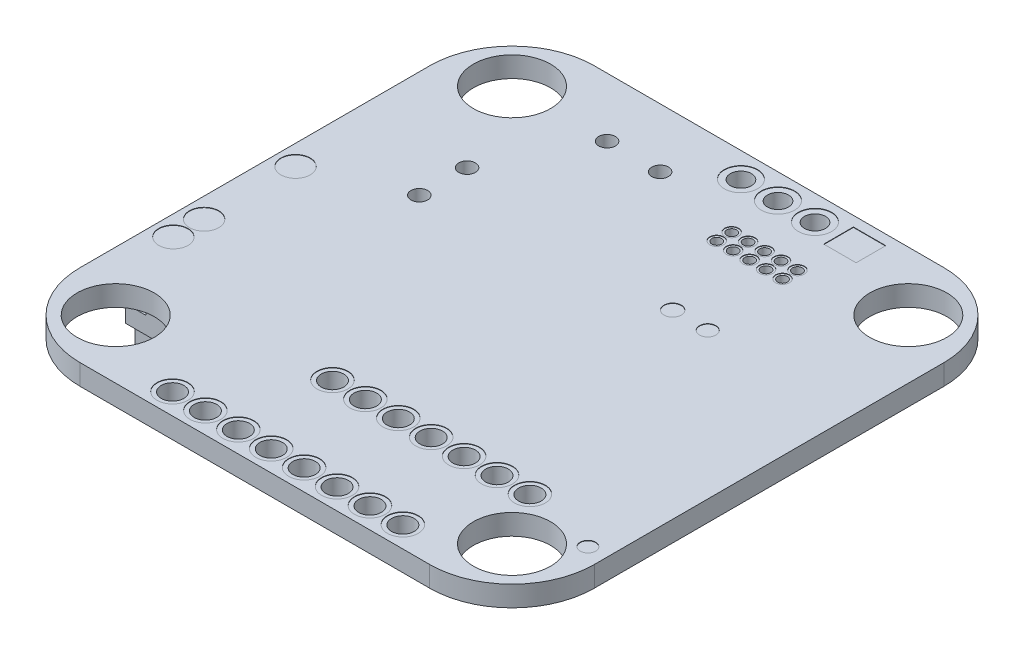
from build123d import *

# Parameters (mm, degrees)
SKETCH1_W           = 31.75
SKETCH1_H           = 31.75
BOSS_EXTRUDE1_DEPTH = 1.27
FILLET1_R           = 5.08
SKETCH2_R           = 2.38125
SKETCH2_R_2         = 0.513227476
CUT_EXTRUDE1_DEPTH  = 2540
SKETCH6_R           = 1.027987033
SKETCH6_R_2         = 0.426271727
SKETCH6_R_3         = 0.905059833
SKETCH6_R_4         = 0.504587533
SKETCH6_R_5         = 0.534547711
SKETCH6_R_6         = 0.478723023
SKETCH6_R_7         = 0.952228923
SKETCH6_W           = 1.997854961
SKETCH6_H           = 1.831367048
CUT_EXTRUDE2_DEPTH  = 0.0254
SKETCH7_W           = 14.734180338
SKETCH7_H           = 15.857973755
SKETCH7_W_2         = 4.578070361
SKETCH7_H_2         = 7.36709017
BOSS_EXTRUDE5_DEPTH = 1.905
SKETCH8_W           = 14.882958641
SKETCH8_H           = 1.379983815
CUT_EXTRUDE3_DEPTH  = 13.97
SKETCH10_W          = 6.798713526
SKETCH10_H          = 1.33450517
CUT_EXTRUDE4_DEPTH  = 3.81
CUT_EXTRUDE5_DEPTH  = 1.27
SKETCH12_W          = 3.03840442
SKETCH12_H          = 3.829222009
SKETCH12_H_2        = 3.995709922
CUT_EXTRUDE6_DEPTH  = 1.27
SKETCH13_W          = 1.664879134
SKETCH13_H          = 9.656298979
CUT_EXTRUDE7_DEPTH  = 0.239775287
SKETCH14_W          = 1.415147264
SKETCH14_H          = 1.456769243
SKETCH14_H_2        = 1.623257156
SKETCH14_W_2        = 1.540013199
SKETCH14_H_3        = 0.832439567
SKETCH14_H_4        = 0.998927481
CUT_EXTRUDE8_DEPTH  = 1.27
BOSS_EXTRUDE6_DEPTH = 4.572
SKETCH16_W          = 0.680432362
SKETCH16_H          = 0.441361532
SKETCH16_W_2        = 0.643652234
SKETCH16_W_3        = 0.555541417
SKETCH16_W_4        = 0.604797181
CUT_EXTRUDE9_DEPTH  = 4.572
SKETCH17_W          = 0.555541417
SKETCH17_H          = 0.734843187
SKETCH17_W_2        = 0.604797181
CUT_EXTRUDE10_DEPTH = 3.048
SKETCH18_W          = 0.555541417
SKETCH18_H          = 0.712608625
SKETCH18_W_2        = 0.604797181
SKETCH18_H_2        = 1.628576262
CUT_EXTRUDE11_DEPTH = 1.27
SKETCH21_R          = 0.698228923
SKETCH21_R_2        = 0.648998018
SKETCH21_R_3        = 0.301620328
CUT_EXTRUDE12_DEPTH = 16.002


with BuildPart() as part:
    # Sketch1 → Boss-Extrude1 (new body)
    with BuildSketch(Plane(origin=(0, 0, 0), x_dir=(1, 0, 0), z_dir=(0, 1, 0))):
        Rectangle(SKETCH1_W, SKETCH1_H)
    extrude(amount=BOSS_EXTRUDE1_DEPTH)

    # Fillet1
    fillet1_edges = [part.edges().sort_by_distance(p)[0] for p in [
        (-15.875, 0.635, -15.875),
        (15.875, 0.635, -15.875),
        (15.875, 0.635, 15.875),
        (-15.875, 0.635, 15.875),
    ]]
    fillet(fillet1_edges, radius=FILLET1_R)

    # Sketch2 → Cut-Extrude1 (cut)
    with BuildSketch(Plane(origin=(0, 1.27, 0), x_dir=(1, 0, 0), z_dir=(0, 1, 0))):
        with Locations(Location((12.235378749, 12.235378749, 0), (0, 0, 270))):
            Circle(SKETCH2_R)
        with Locations(Location((-12.235378749, 12.235378749, 0), (0, 0, 270))):
            Circle(SKETCH2_R)
        with Locations(Location((-12.235378749, -12.235378749, 0), (0, 0, 270))):
            Circle(SKETCH2_R)
        with Locations(Location((12.235378749, -12.235378749, 0), (0, 0, 270))):
            Circle(SKETCH2_R)
        with Locations(Location((-6.365121013, 12.235378749, 0), (0, 0, 270))):
            Circle(SKETCH2_R_2)
        with Locations(Location((-3.088320071, 12.235378749, 0), (0, 0, 270))):
            Circle(SKETCH2_R_2)
        with Locations(Location((-9.273281849, 6.498808589, 0), (0, 0, 270))):
            Circle(SKETCH2_R_2)
        with Locations(Location((-9.273281849, 3.549687741, 0), (0, 0, 270))):
            Circle(SKETCH2_R_2)
    extrude(amount=-CUT_EXTRUDE1_DEPTH, mode=Mode.SUBTRACT)

    # Sketch6 → Cut-Extrude2 (cut)
    with BuildSketch(Plane(origin=(0, 1.27, 0), x_dir=(1, 0, 0), z_dir=(0, 1, 0))):
        with Locations(Location((4.370307728, 14.338771544, 0), (0, 0, 270))):
            Circle(SKETCH6_R)
        with Locations(Location((2.084307728, 14.338771544, 0), (0, 0, 270))):
            Circle(SKETCH6_R)
        with Locations(Location((-0.201692272, 14.338771544, 0), (0, 0, 270))):
            Circle(SKETCH6_R)
        with Locations(Location((6.409784667, 11.217123168, 0), (0, 0, 270))):
            Circle(SKETCH6_R_2)
        with Locations(Location((6.409784667, 10.293398218, 0), (0, 0, 270))):
            Circle(SKETCH6_R_2)
        with Locations(Location((5.393784667, 11.217123168, 0), (0, 0, 270))):
            Circle(SKETCH6_R_2)
        with Locations(Location((5.393784667, 10.293398218, 0), (0, 0, 270))):
            Circle(SKETCH6_R_2)
        with Locations(Location((4.377784667, 11.217123168, 0), (0, 0, 270))):
            Circle(SKETCH6_R_2)
        with Locations(Location((4.377784667, 10.293398218, 0), (0, 0, 270))):
            Circle(SKETCH6_R_2)
        with Locations(Location((3.361784667, 11.217123168, 0), (0, 0, 270))):
            Circle(SKETCH6_R_2)
        with Locations(Location((3.361784667, 10.293398218, 0), (0, 0, 270))):
            Circle(SKETCH6_R_2)
        with Locations(Location((2.345784667, 11.217123168, 0), (0, 0, 270))):
            Circle(SKETCH6_R_2)
        with Locations(Location((2.345784667, 10.293398218, 0), (0, 0, 270))):
            Circle(SKETCH6_R_2)
        with Locations(Location((-14.634699345, 1.269473008, 0), (0, 0, 270))):
            Circle(SKETCH6_R_3)
        with Locations(Location((-14.634699345, -4.375397019, 0), (0, 0, 270))):
            Circle(SKETCH6_R_3)
        with Locations(Location((-14.634699345, -6.273101018, 0), (0, 0, 270))):
            Circle(SKETCH6_R_3)
        with Locations(Location((6.855725392, 5.229884908, 0), (0, 0, 270))):
            Circle(SKETCH6_R_4)
        with Locations(Location((4.691431935, 5.229884908, 0), (0, 0, 270))):
            Circle(SKETCH6_R_5)
        with Locations(Location((14.725883417, -10.038221661, 0), (0, 0, 270))):
            Circle(SKETCH6_R_6)
        with Locations(Location((10.121840972, -9.015101117, 0), (0, 0, 270))):
            Circle(SKETCH6_R_7)
        with Locations(Location((8.089840972, -9.015101117, 0), (0, 0, 270))):
            Circle(SKETCH6_R_7)
        with Locations(Location((6.057840972, -9.015101117, 0), (0, 0, 270))):
            Circle(SKETCH6_R_7)
        with Locations(Location((4.025840972, -9.015101117, 0), (0, 0, 270))):
            Circle(SKETCH6_R_7)
        with Locations(Location((1.993840972, -9.015101117, 0), (0, 0, 270))):
            Circle(SKETCH6_R_7)
        with Locations(Location((-0.038159028, -9.015101117, 0), (0, 0, 270))):
            Circle(SKETCH6_R_7)
        with Locations(Location((-2.070159028, -9.015101117, 0), (0, 0, 270))):
            Circle(SKETCH6_R_7)
        with Locations(Location((7.824931931, -14.563562525, 0), (0, 0, 270))):
            Circle(SKETCH6_R_7)
        with Locations(Location((5.792931931, -14.563562525, 0), (0, 0, 270))):
            Circle(SKETCH6_R_7)
        with Locations(Location((3.760931931, -14.563562525, 0), (0, 0, 270))):
            Circle(SKETCH6_R_7)
        with Locations(Location((1.728931931, -14.563562525, 0), (0, 0, 270))):
            Circle(SKETCH6_R_7)
        with Locations(Location((-0.303068069, -14.563562525, 0), (0, 0, 270))):
            Circle(SKETCH6_R_7)
        with Locations(Location((-2.335068069, -14.563562525, 0), (0, 0, 270))):
            Circle(SKETCH6_R_7)
        with Locations(Location((-4.367068069, -14.563562525, 0), (0, 0, 270))):
            Circle(SKETCH6_R_7)
        with Locations(Location((-6.399068069, -14.563562525, 0), (0, 0, 270))):
            Circle(SKETCH6_R_7)
        with Locations((6.826004451, 14.338771544)):
            Rectangle(SKETCH6_W, SKETCH6_H)
    extrude(amount=-CUT_EXTRUDE2_DEPTH, mode=Mode.SUBTRACT)

    # Sketch7 → Boss-Extrude5 (add)
    with BuildSketch(Plane.XZ):
        with Locations((5.223558284, -0.853250556)):
            Rectangle(SKETCH7_W, SKETCH7_H)
        with Locations((-13.089938565, -5.098692349)):
            Rectangle(SKETCH7_W_2, SKETCH7_H_2)
    extrude(amount=BOSS_EXTRUDE5_DEPTH)

    # Sketch8 → Cut-Extrude3 (cut)
    with BuildSketch(Plane(origin=(12.590648453, 0, 0), x_dir=(0, 0, -1), z_dir=(1, 0, 0))):
        with Locations((0.833352515, -0.929767195)):
            Rectangle(SKETCH8_W, SKETCH8_H)
    extrude(amount=-CUT_EXTRUDE3_DEPTH, mode=Mode.SUBTRACT)

    # Sketch10 → Cut-Extrude4 (cut)
    with BuildSketch(Plane.ZY.offset(15.378973745)):
        with Locations((-5.097593598, -0.899949488)):
            Rectangle(SKETCH10_W, SKETCH10_H)
    extrude(amount=-CUT_EXTRUDE4_DEPTH, mode=Mode.SUBTRACT)

    # Sketch11 → Cut-Extrude5 (cut)
    with BuildSketch(Plane.XZ.offset(1.905)):
        Polygon((12.590648453, 3.973420502), (7.75794531, 1.103415111), (7.75794531, -5.717764563), (12.590648453, -7.603711228), align=None)
    extrude(amount=-CUT_EXTRUDE5_DEPTH, mode=Mode.SUBTRACT)

    # Sketch12 → Cut-Extrude6 (cut)
    with BuildSketch(Plane.XZ.offset(0.239775287)):
        with Locations((4.953015425, -1.373525285)):
            Rectangle(SKETCH12_W, SKETCH12_H)
        with Locations((4.953015425, -5.82707697)):
            Rectangle(SKETCH12_W, SKETCH12_H_2)
    extrude(amount=-CUT_EXTRUDE6_DEPTH, mode=Mode.SUBTRACT)

    # Sketch13 → Cut-Extrude7 (cut)
    with BuildSketch(Plane.XZ.offset(0.239775287)):
        with Locations((11.758208886, -2.830294529)):
            Rectangle(SKETCH13_W, SKETCH13_H)
    extrude(amount=-CUT_EXTRUDE7_DEPTH, mode=Mode.SUBTRACT)

    # Sketch14 → Cut-Extrude8 (cut)
    with BuildSketch(Plane.XZ.offset(1.905)):
        with Locations((-11.508477016, -3.433813214)):
            Rectangle(SKETCH14_W, SKETCH14_H)
        with Locations((-11.508477016, -7.013303353)):
            Rectangle(SKETCH14_W, SKETCH14_H_2)
        with Locations((-14.109850664, -2.705428594)):
            Rectangle(SKETCH14_W_2, SKETCH14_H_3)
        with Locations((-14.109850664, -7.61682204)):
            Rectangle(SKETCH14_W_2, SKETCH14_H_4)
    extrude(amount=-CUT_EXTRUDE8_DEPTH, mode=Mode.SUBTRACT)

    # Sketch15 → Boss-Extrude6 (add)
    with BuildSketch(Plane(origin=(0, 0, 0), x_dir=(-1, 0, 0), z_dir=(0, -1, 0))):
        Polygon((9.302512163, -1.706501113), (9.302512163, -0.964616609), (15.461197982, -0.964616609), (15.461197982, -8.414357038), (9.302512163, -8.414357038), (9.302512163, -7.700065996), (10.884147341, -7.700065996), (10.884147341, -1.706501113), align=None)
    extrude(amount=BOSS_EXTRUDE6_DEPTH)

    # Sketch16 → Cut-Extrude9 (cut)
    # profile 1 of 3: a face of its own
    with BuildSketch(Plane.ZY.offset(15.461197982)):
        Polygon((5.23495092, -3.826913807), (7.461685575, -3.826913807), (7.461685575, -0.867969527), (1.994071145, -0.867969527), (1.994071145, -3.826913807), (4.149937154, -3.826913807), (4.149937154, -4.264732145), (5.23495092, -4.264732145), align=None)
        with Locations((3.276409122, -2.903867422)):
            Rectangle(SKETCH16_W, SKETCH16_H, mode=Mode.SUBTRACT)
        with Locations((6.200429272, -2.903867422)):
            Rectangle(SKETCH16_W_2, SKETCH16_H, mode=Mode.SUBTRACT)
    # profile 2 of 3: a face of its own
    with BuildSketch(Plane.ZY.offset(15.461197982)):
        with Locations((1.242387317, -2.903867422)):
            Rectangle(SKETCH16_W_3, SKETCH16_H)
    # profile 3 of 3: a face of its own
    with BuildSketch(Plane.ZY.offset(15.461197982)):
        with Locations((8.111958448, -2.903867422)):
            Rectangle(SKETCH16_W_4, SKETCH16_H)
    extrude(amount=-CUT_EXTRUDE9_DEPTH, mode=Mode.SUBTRACT)

    # Sketch17 → Cut-Extrude10 (cut)
    with BuildSketch(Plane.ZY.offset(15.461197982)):
        with Locations((1.242387317, -3.491969782)):
            Rectangle(SKETCH17_W, SKETCH17_H)
        with Locations((8.111958448, -3.491969782)):
            Rectangle(SKETCH17_W_2, SKETCH17_H)
    extrude(amount=-CUT_EXTRUDE10_DEPTH, mode=Mode.SUBTRACT)

    # Sketch18 → Cut-Extrude11 (cut)
    with BuildSketch(Plane.ZY.offset(15.461197982)):
        with Locations((1.242387317, -4.215695688)):
            Rectangle(SKETCH18_W, SKETCH18_H)
        with Locations((8.111958448, -4.215695688)):
            Rectangle(SKETCH18_W_2, SKETCH18_H)
        with Locations((1.242387317, -0.814288131)):
            Rectangle(SKETCH18_W, SKETCH18_H_2)
        with Locations((8.111958448, -0.814288131)):
            Rectangle(SKETCH18_W_2, SKETCH18_H_2)
    extrude(amount=-CUT_EXTRUDE11_DEPTH, mode=Mode.SUBTRACT)

    # Sketch21 → Cut-Extrude12 (cut)
    with BuildSketch(Plane(origin=(0, 1.2446, 0), x_dir=(1, 0, 0), z_dir=(0, 1, 0))):
        with Locations(Location((-6.399068069, -14.563562525, 0), (0, 0, 270))):
            Circle(SKETCH21_R)
        with Locations(Location((-4.367068069, -14.563562525, 0), (0, 0, 270))):
            Circle(SKETCH21_R)
        with Locations(Location((-0.303068069, -14.563562525, 0), (0, 0, 270))):
            Circle(SKETCH21_R)
        with Locations(Location((-2.335068069, -14.563562525, 0), (0, 0, 270))):
            Circle(SKETCH21_R)
        with Locations(Location((1.728931931, -14.563562525, 0), (0, 0, 270))):
            Circle(SKETCH21_R)
        with Locations(Location((3.760931931, -14.563562525, 0), (0, 0, 270))):
            Circle(SKETCH21_R)
        with Locations(Location((5.792931931, -14.563562525, 0), (0, 0, 270))):
            Circle(SKETCH21_R)
        with Locations(Location((7.824931931, -14.563562525, 0), (0, 0, 270))):
            Circle(SKETCH21_R)
        with Locations(Location((-0.038159028, -9.015101117, 0), (0, 0, 270))):
            Circle(SKETCH21_R)
        with Locations(Location((-2.070159028, -9.015101117, 0), (0, 0, 270))):
            Circle(SKETCH21_R)
        with Locations(Location((1.993840972, -9.015101117, 0), (0, 0, 270))):
            Circle(SKETCH21_R)
        with Locations(Location((4.025840972, -9.015101117, 0), (0, 0, 270))):
            Circle(SKETCH21_R)
        with Locations(Location((6.057840972, -9.015101117, 0), (0, 0, 270))):
            Circle(SKETCH21_R)
        with Locations(Location((8.089840972, -9.015101117, 0), (0, 0, 270))):
            Circle(SKETCH21_R)
        with Locations(Location((10.121840972, -9.015101117, 0), (0, 0, 270))):
            Circle(SKETCH21_R)
        with Locations(Location((4.370307728, 14.338771544, 0), (0, 0, 270))):
            Circle(SKETCH21_R_2)
        with Locations(Location((2.084307728, 14.338771544, 0), (0, 0, 270))):
            Circle(SKETCH21_R_2)
        with Locations(Location((-0.201692272, 14.338771544, 0), (0, 0, 270))):
            Circle(SKETCH21_R_2)
        with Locations(Location((6.409784667, 11.217123168, 0), (0, 0, 270))):
            Circle(SKETCH21_R_3)
        with Locations(Location((6.409784667, 10.293398218, 0), (0, 0, 270))):
            Circle(SKETCH21_R_3)
        with Locations(Location((5.393784667, 11.217123168, 0), (0, 0, 270))):
            Circle(SKETCH21_R_3)
        with Locations(Location((5.393784667, 10.293398218, 0), (0, 0, 270))):
            Circle(SKETCH21_R_3)
        with Locations(Location((4.377784667, 11.217123168, 0), (0, 0, 270))):
            Circle(SKETCH21_R_3)
        with Locations(Location((4.377784667, 10.293398218, 0), (0, 0, 270))):
            Circle(SKETCH21_R_3)
        with Locations(Location((3.361784667, 11.217123168, 0), (0, 0, 270))):
            Circle(SKETCH21_R_3)
        with Locations(Location((3.361784667, 10.293398218, 0), (0, 0, 270))):
            Circle(SKETCH21_R_3)
        with Locations(Location((2.345784667, 11.217123168, 0), (0, 0, 270))):
            Circle(SKETCH21_R_3)
        with Locations(Location((2.345784667, 10.293398218, 0), (0, 0, 270))):
            Circle(SKETCH21_R_3)
    extrude(amount=-CUT_EXTRUDE12_DEPTH, mode=Mode.SUBTRACT)


solid = part.part
